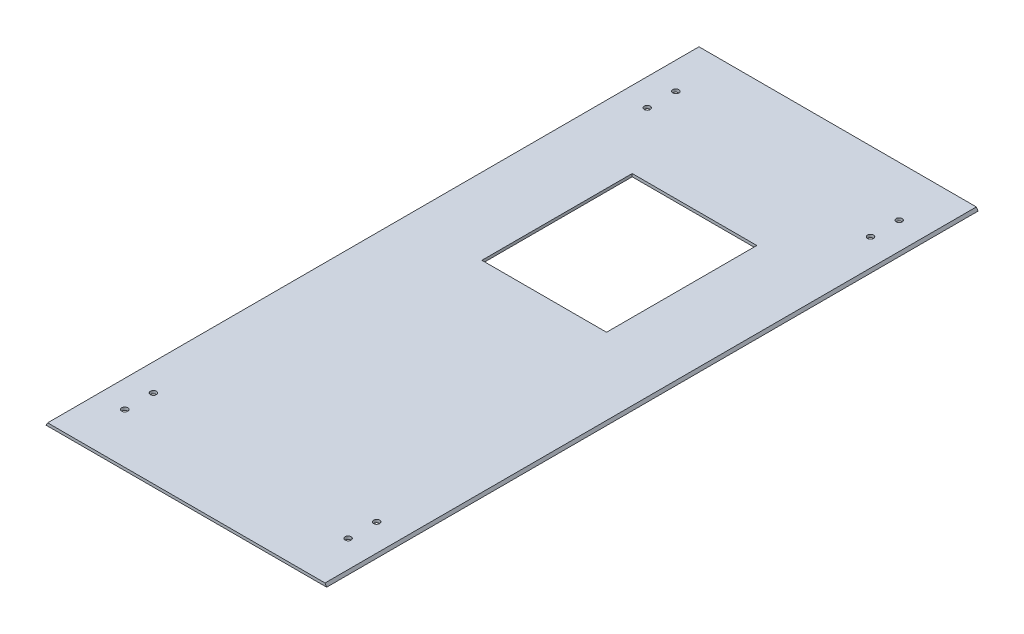
from build123d import *

# Parameters (mm, degrees)
EXTRUDE_1_DEPTH     = 455
SKETCH_3_R          = 2.1
CUT_EXTRUDE_1_DEPTH = 466.453246739
SKETCH_7_W          = 87.07
SKETCH_7_H          = 105
CUT_EXTRUDE_2_DEPTH = 10


with BuildPart() as part:
    # 草图2 → 凸台-拉伸1 (new body)
    with BuildSketch(Plane.XY):
        Polygon((-98, -1), (-96.845299462, 1), (96.915299462, 1), (98.07, -1), align=None)
    extrude(amount=-EXTRUDE_1_DEPTH)

    # 草图3 → 切除-拉伸1 (cut, through all)
    with BuildSketch(Plane(origin=(0, -1, 0), x_dir=(-1, 0, 0), z_dir=(0, -1, 0))):
        with Locations(Location((78, 35, 0), (0, 0, 90))):
            Circle(SKETCH_3_R)
        with Locations(Location((78, 55, 0), (0, 0, 90))):
            Circle(SKETCH_3_R)
        with Locations(Location((-78, 55, 0), (0, 0, 270))):
            Circle(SKETCH_3_R)
        with Locations(Location((-78, 35, 0), (0, 0, 270))):
            Circle(SKETCH_3_R)
        with Locations(Location((-78, 420, 0), (0, 0, 90))):
            Circle(SKETCH_3_R)
        with Locations(Location((-78, 400, 0), (0, 0, 90))):
            Circle(SKETCH_3_R)
        with Locations(Location((78, 400, 0), (0, 0, 270))):
            Circle(SKETCH_3_R)
        with Locations(Location((78, 420, 0), (0, 0, 270))):
            Circle(SKETCH_3_R)
    extrude(amount=-CUT_EXTRUDE_1_DEPTH, mode=Mode.SUBTRACT)

    # 草图7 → 切除-拉伸2 (cut)
    with BuildSketch(Plane.XZ.offset(1)):
        with Locations((0.035, -302.5)):
            Rectangle(SKETCH_7_W, SKETCH_7_H)
    extrude(amount=-CUT_EXTRUDE_2_DEPTH, mode=Mode.SUBTRACT)


solid = part.part
